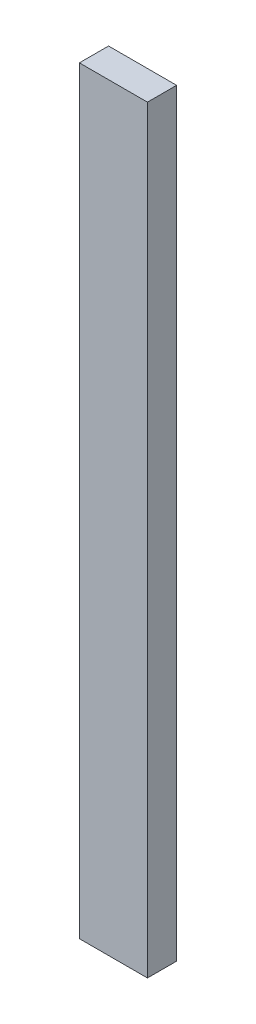
from build123d import *

# Parameters (mm, degrees)
SKETCH1_W           = 88.9
SKETCH1_H           = 38.1
BOSS_EXTRUDE1_DEPTH = 990.6


with BuildPart() as part:
    # Sketch1 → Boss-Extrude1 (new body)
    with BuildSketch(Plane(origin=(0, 0, 0), x_dir=(1, 0, 0), z_dir=(0, 1, 0))):
        Rectangle(SKETCH1_W, SKETCH1_H)
    extrude(amount=BOSS_EXTRUDE1_DEPTH)


solid = part.part
